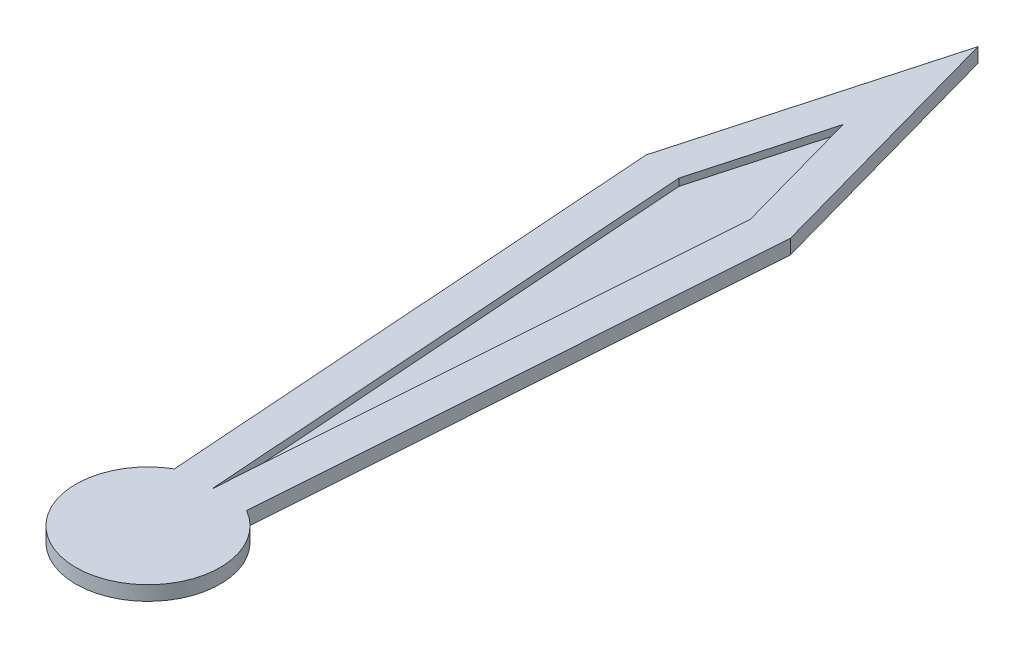
from build123d import *

# Parameters (mm, degrees)
EXTRUDE1_DEPTH = 0.2
EXTRUDE2_DEPTH = 0.1


with BuildPart() as part:
    # Sketch1 → Extrude1 (new body)
    with BuildSketch(Plane(origin=(0, 0, 0), x_dir=(1, 0, 0), z_dir=(0, 1, 0))):
        with BuildLine():
            Line((0, 11.5), (1, 7.9))
            Line((1, 7.9), (0.5, 0.866025404))
            ThreePointArc((0.5, 0.866025404), (0, -1), (-0.5, 0.866025404))
            Line((-0.5, 0.866025404), (-1, 7.9))
            Line((-1, 7.9), (0, 11.5))
        make_face()
    extrude(amount=EXTRUDE1_DEPTH)

    # Sketch2 → Extrude2 (cut)
    with BuildSketch(Plane(origin=(0, 0.2, 0), x_dir=(1, 0, 0), z_dir=(0, 1, 0))):
        Polygon((-0.001258451, 0.901477732), (0.001258451, 0.901477732), (0.495137938, 7.849349255), (0, 9.631845831), (-0.495137938, 7.849349255), align=None)
    extrude(amount=-EXTRUDE2_DEPTH, mode=Mode.SUBTRACT)


solid = part.part
